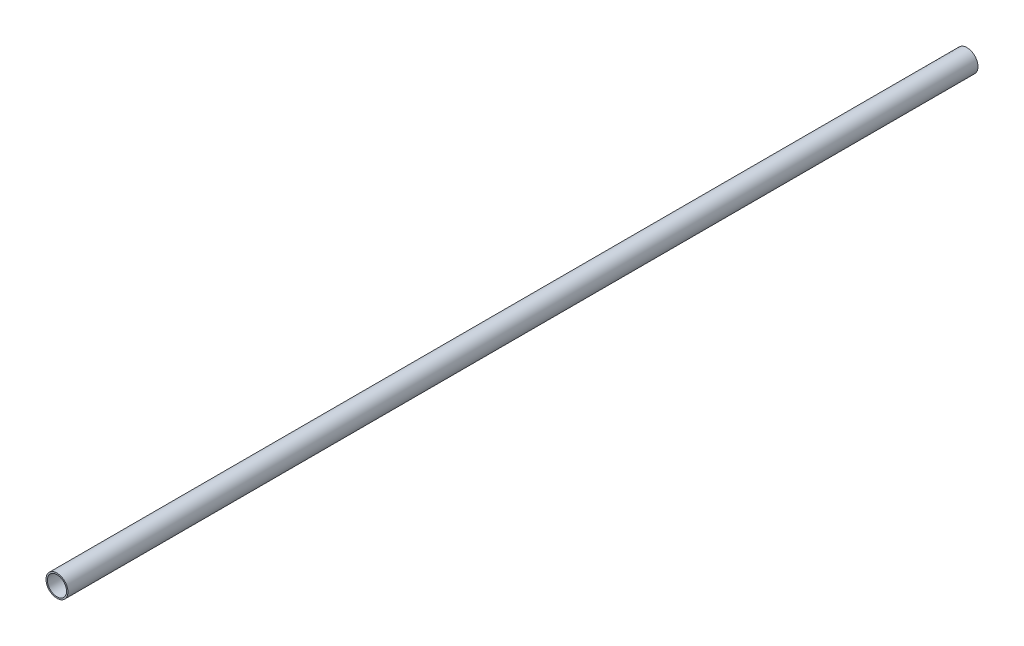
from build123d import *

# Parameters (mm, degrees)
SKETCH2_R           = 24.125
SKETCH2_R_2         = 21.075
BOSS_EXTRUDE1_DEPTH = 2000


with BuildPart() as part:
    # Sketch2 → Boss-Extrude1 (new body)
    with BuildSketch(Plane.XY):
        with Locations((2449.72011288, -5187.007415734)):
            Circle(SKETCH2_R)
        with Locations((2449.72011288, -5187.007415734)):
            Circle(SKETCH2_R_2, mode=Mode.SUBTRACT)
    extrude(amount=BOSS_EXTRUDE1_DEPTH)


solid = part.part
